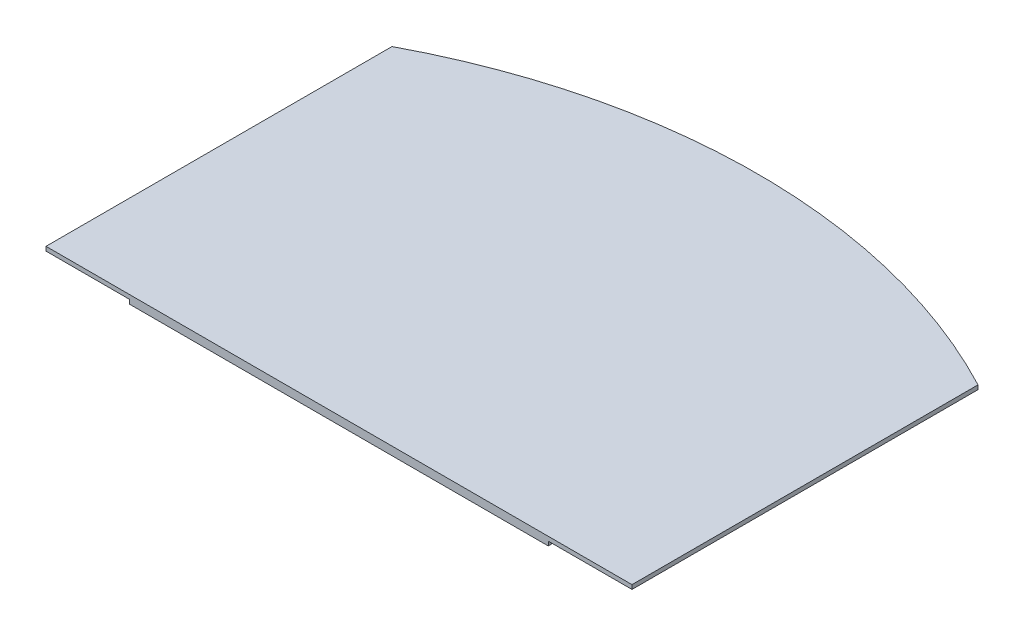
from build123d import *

# Parameters (mm, degrees)
BOSS_EXTRUDE3_DEPTH = 2
BOSS_EXTRUDE4_DEPTH = 1
CUT_EXTRUDE4_DEPTH  = 1
CUT_EXTRUDE5_DEPTH  = 1
SKETCH7_W           = 100
SKETCH7_H           = 20.041590073
CUT_EXTRUDE6_DEPTH  = 166.541535573


with BuildPart() as part:
    # Sketch1 → Boss-Extrude3 (new body)
    with BuildSketch(Plane(origin=(0, 0, 0), x_dir=(1, 0, 0), z_dir=(0, 1, 0))):
        with BuildLine():
            Line((50, 29.958409927), (50, 50))
            Line((50, 50), (70, 50))
            Line((70, 50), (70, 132.664991614))
            ThreePointArc((70, 132.664991614), (0, 150), (-70, 132.664991614))
            Line((-70, 132.664991614), (-70, 50))
            Line((-70, 50), (-50, 50))
            Line((-50, 50), (-50, 29.958409927))
            Line((-50, 29.958409927), (50, 29.958409927))
        make_face()
    extrude(amount=BOSS_EXTRUDE3_DEPTH)

    # Sketch2 → Boss-Extrude4 (add)
    with BuildSketch(Plane.XZ):
        with BuildLine():
            Line((50, -50), (-50, -50))
            Line((-50, -50), (-50, -141.421356237))
            ThreePointArc((-50, -141.421356237), (0, -150), (50, -141.421356237))
            Line((50, -141.421356237), (50, -50))
        make_face()
    extrude(amount=-BOSS_EXTRUDE4_DEPTH)

    # Sketch5 → Cut-Extrude4 (cut)
    with BuildSketch(Plane.XZ):
        with BuildLine():
            Line((-50, -141.421356237), (-50, -50))
            Line((-50, -50), (-70, -50))
            Line((-70, -50), (-70, -132.664991614))
            ThreePointArc((-70, -132.664991614), (-60.159525267, -137.407538074), (-50, -141.421356237))
        make_face()
    extrude(amount=-CUT_EXTRUDE4_DEPTH, mode=Mode.SUBTRACT)

    # Sketch6 → Cut-Extrude5 (cut)
    with BuildSketch(Plane.XZ):
        with BuildLine():
            ThreePointArc((50, -141.421356237), (60.159525267, -137.407538074), (70, -132.664991614))
            Line((70, -132.664991614), (70, -50))
            Line((70, -50), (50, -50))
            Line((50, -50), (50, -141.421356237))
        make_face()
    extrude(amount=-CUT_EXTRUDE5_DEPTH, mode=Mode.SUBTRACT)

    # Sketch7 → Cut-Extrude6 (cut, through all)
    with BuildSketch(Plane.XZ):
        with Locations((0, -39.979204964)):
            Rectangle(SKETCH7_W, SKETCH7_H)
    extrude(amount=-CUT_EXTRUDE6_DEPTH, mode=Mode.SUBTRACT)


solid = part.part
